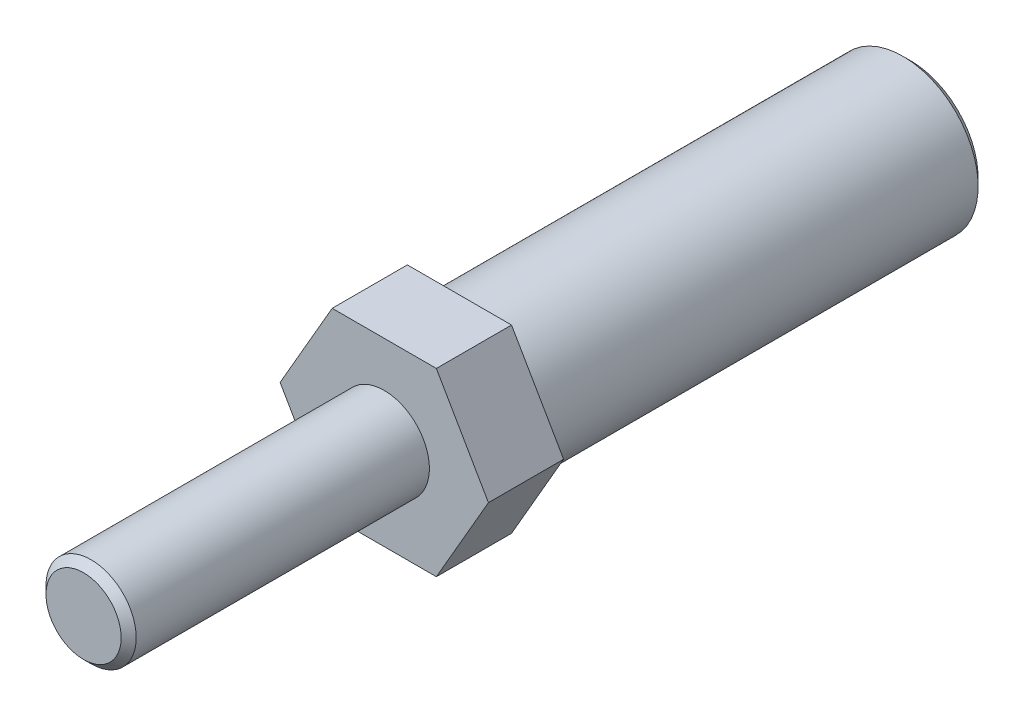
from build123d import *

# Parameters (mm, degrees)
EXTRUS_O1_DEPTH = 2.5
ESBO_O2_R       = 3
EXTRUS_O2_DEPTH = 20
ESBO_O3_R       = 5
EXTRUS_O3_DEPTH = 30
CHANFRO1_SIZE   = 0.5


with BuildPart() as part:
    # Esboço1 → Extrusão1 (new, symmetric)
    with BuildSketch(Plane.XY):
        Polygon((6.92820323, 0), (3.464101615, 6), (-3.464101615, 6), (-6.92820323, 0), (-3.464101615, -6), (3.464101615, -6), align=None)
    extrude(amount=EXTRUS_O1_DEPTH, both=True)

    # Esboço2 → Extrusão2 (add)
    with BuildSketch(Plane.XY.offset(2.5)):
        with Locations(Location((0, 0, 0), (0, 0, 180))):
            Circle(ESBO_O2_R)
    extrude(amount=EXTRUS_O2_DEPTH)

    # Esboço3 → Extrusão3 (add)
    with BuildSketch(Plane(origin=(0, 0, -2.5), x_dir=(-1, 0, 0), z_dir=(0, 0, -1))):
        Circle(ESBO_O3_R)
    extrude(amount=EXTRUS_O3_DEPTH)

    # Chanfro1
    chanfro1_edges = [part.edges().sort_by_distance(p)[0] for p in [
        (3, 0, 22.5),
        (5, 0, -32.5),
    ]]
    chamfer(chanfro1_edges, length=CHANFRO1_SIZE)


solid = part.part
